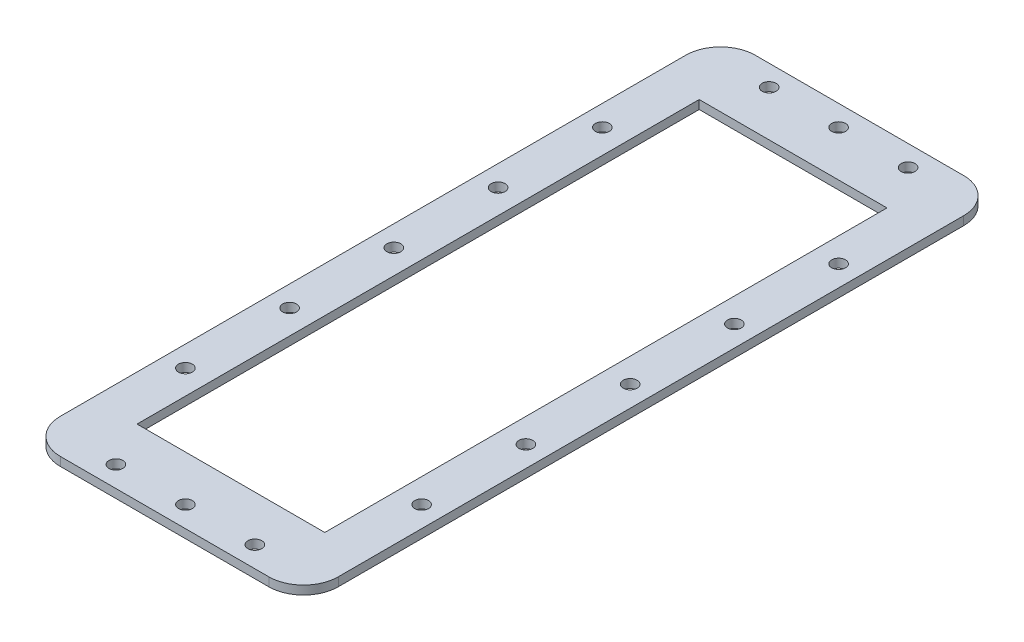
from build123d import *

# Parameters (mm, degrees)
SKETCH1_W           = 101.6
SKETCH1_H           = 254
BOSS_EXTRUDE1_DEPTH = 3.175
SKETCH2_R           = 2.54
CUT_EXTRUDE1_DEPTH  = 223.663234681
FILLET1_R           = 12.7
SKETCH4_W           = 68.631417281
SKETCH4_H           = 205.47036429
CUT_EXTRUDE2_DEPTH  = 223.663234681


with BuildPart() as part:
    # Sketch1 → Boss-Extrude1 (new body)
    with BuildSketch(Plane(origin=(0, 0, 0), x_dir=(1, 0, 0), z_dir=(0, 1, 0))):
        with Locations((20.100372359, -84.049692378)):
            Rectangle(SKETCH1_W, SKETCH1_H)
    extrude(amount=BOSS_EXTRUDE1_DEPTH)

    # Sketch2 → Cut-Extrude1 (cut, through all)
    with BuildSketch(Plane(origin=(0, 3.175, 0), x_dir=(1, 0, 0), z_dir=(0, 1, 0))):
        with Locations((-5.299627641, 35.330307622)):
            Circle(SKETCH2_R)
        with Locations((20.100372359, 35.330307622)):
            Circle(SKETCH2_R)
        with Locations((45.500372359, 35.330307622)):
            Circle(SKETCH2_R)
        with Locations((-23.079627641, -84.049692378)):
            Circle(SKETCH2_R)
        with Locations((-23.079627641, -45.949692378)):
            Circle(SKETCH2_R)
        with Locations((-23.079627641, -7.849692378)):
            Circle(SKETCH2_R)
        with Locations((63.280372359, -7.849692378)):
            Circle(SKETCH2_R)
        with Locations((63.280372359, -45.949692378)):
            Circle(SKETCH2_R)
        with Locations((63.280372359, -84.049692378)):
            Circle(SKETCH2_R)
        with Locations((63.280372359, -122.149692378)):
            Circle(SKETCH2_R)
        with Locations((63.280372359, -160.249692378)):
            Circle(SKETCH2_R)
        with Locations((-23.079627641, -160.249692378)):
            Circle(SKETCH2_R)
        with Locations((-23.079627641, -122.149692378)):
            Circle(SKETCH2_R)
        with Locations((45.500372359, -203.429692378)):
            Circle(SKETCH2_R)
        with Locations((20.100372359, -203.429692378)):
            Circle(SKETCH2_R)
        with Locations((-5.299627641, -203.429692378)):
            Circle(SKETCH2_R)
    extrude(amount=-CUT_EXTRUDE1_DEPTH, mode=Mode.SUBTRACT)

    # Fillet1
    fillet1_edges = [part.edges().sort_by_distance(p)[0] for p in [
        (-30.699627641, 1.5875, 211.049692378),
        (70.900372359, 1.5875, 211.049692378),
        (70.900372359, 1.5875, -42.950307622),
        (-30.699627641, 1.5875, -42.950307622),
    ]]
    fillet(fillet1_edges, radius=FILLET1_R)

    # Sketch4 → Cut-Extrude2 (cut, through all)
    with BuildSketch(Plane(origin=(0, 3.175, 0), x_dir=(1, 0, 0), z_dir=(0, 1, 0))):
        with Locations((20.100372358, -84.049692378)):
            Rectangle(SKETCH4_W, SKETCH4_H)
    extrude(amount=-CUT_EXTRUDE2_DEPTH, mode=Mode.SUBTRACT)


solid = part.part
